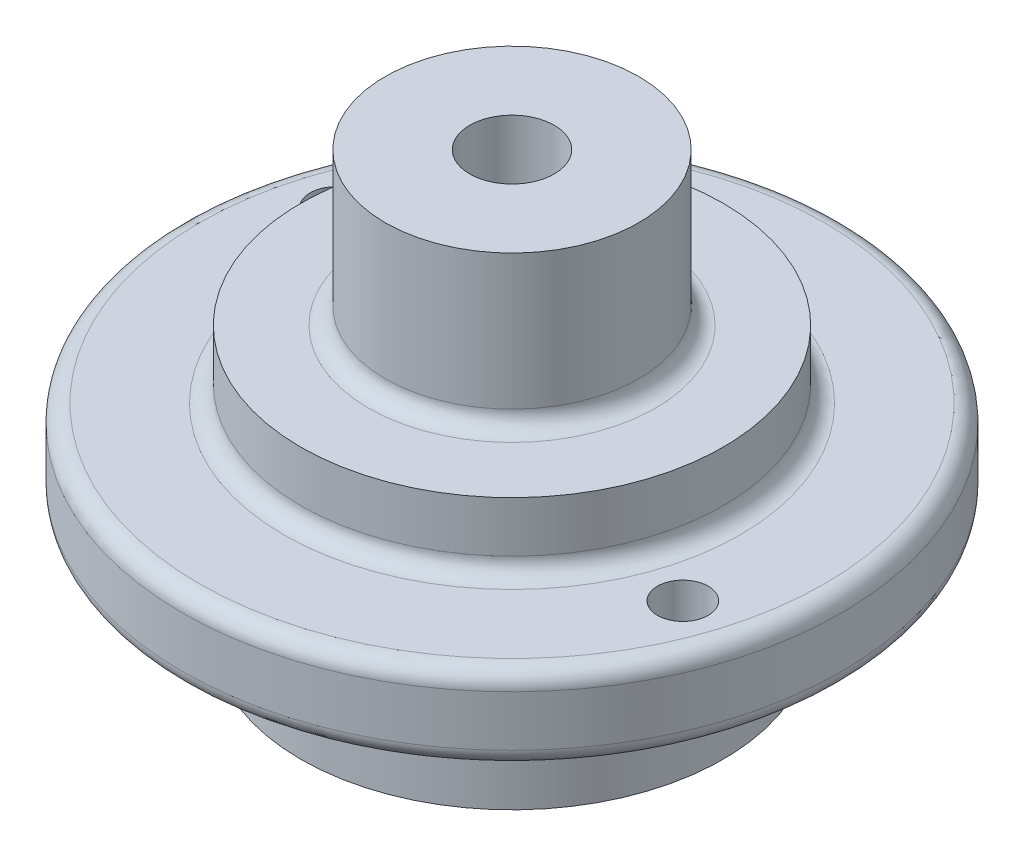
from build123d import *

# Parameters (mm, degrees)
FILLET1_R          = 1
FILLET2_R          = 1
SKETCH3_R          = 1.5
CUT_EXTRUDE1_DEPTH = 20


with BuildPart() as part:
    # Sketch2 → Revolve1 (revolve)
    with BuildSketch(Plane(origin=(0, 0, 0), x_dir=(0, 0, -1), z_dir=(1, 0, 0))):
        Polygon((-2.5, 43.227272727), (-2.5, 36.227272727), (-5, 36.227272727), (-5, 30.227272727), (-8.25, 30.227272727), (-8.25, 18.227272727), (-12.5, 18.227272727), (-12.5, 25.227272727), (-19.5, 25.227272727), (-19.5, 30.227272727), (-12.5, 30.227272727), (-12.5, 34.227272727), (-7.5, 34.227272727), (-7.5, 43.227272727), align=None)
    revolve(axis=Axis((0, 55.454545455, 0), (0, -1, 0)))

    # Fillet1
    fillet1_edges = [part.edges().sort_by_distance(p)[0] for p in [
        (0, 30.227272727, -12.5),
        (0, 34.227272727, -7.5),
    ]]
    fillet(fillet1_edges, radius=FILLET1_R)

    # Fillet2
    fillet2_edges = [part.edges().sort_by_distance(p)[0] for p in [
        (0, 25.227272727, -19.5),
        (0, 30.227272727, -19.5),
    ]]
    fillet(fillet2_edges, radius=FILLET2_R)

    # Sketch3 → Cut-Extrude1 (cut)
    with BuildSketch(Plane(origin=(0, 30.227272727, 0), x_dir=(1, 0, 0), z_dir=(0, 1, 0))):
        with Locations((15.176066716, -5.068234312)):
            Circle(SKETCH3_R)
        with Locations((-15.258311064, 4.814970764)):
            Circle(SKETCH3_R)
    extrude(amount=-CUT_EXTRUDE1_DEPTH, mode=Mode.SUBTRACT)


solid = part.part
